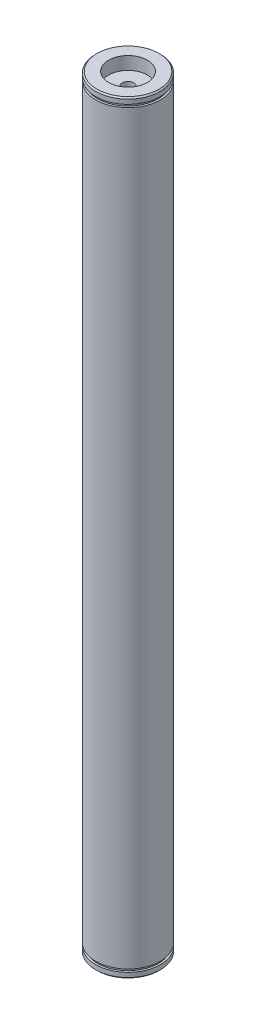
from build123d import *

# Parameters (mm, degrees)
SKETCH_1_R                = 25
EXTRUDE_1_DEPTH           = 295.5
SKETCH_2_R                = 15
CUT_EXTRUDE_1_DEPTH       = 10
HOLE_WIZARD_8_0_8_1_D     = 8
HOLE_WIZARD_8_0_8_1_DEPTH = 119
HOLE_WIZARD_8_0_8_1_TIP   = 2.403442476
SKETCH_5_R                = 3
CUT_EXTRUDE_2_DEPTH       = 100
M10X1_0_1_D               = 9
M10X1_0_1_DEPTH           = 25
M10X1_0_1_TIP             = 2.703872786
CUT_EXTRUDE_START         = -10
SKETCH_8_R                = 15
CUT_EXTRUDE_3_DEPTH       = 10
HOLE_WIZARD_8_0_8_2_D     = 8
HOLE_WIZARD_8_0_8_2_DEPTH = 119
HOLE_WIZARD_8_0_8_2_TIP   = 2.403442476
M10X1_0_2_D               = 9
M10X1_0_2_DEPTH           = 25
M10X1_0_2_TIP             = 2.703872786
SKETCH_12_R               = 3
CUT_EXTRUDE_4_DEPTH       = 51
CHAMFER_1_SIZE            = 1
SKETCH_14_W               = 1.5
SKETCH_14_H               = 2.2


with BuildPart() as part:
    # 草图1 → 凸台-拉伸1 (new, symmetric)
    with BuildSketch(Plane(origin=(0, 0, 0), x_dir=(1, 0, 0), z_dir=(0, 1, 0))):
        with Locations(Location((0, 0, 0), (0, 0, 270))):
            Circle(SKETCH_1_R)
    extrude(amount=EXTRUDE_1_DEPTH, both=True)

    # 草图2 → 切除-拉伸1 (cut)
    with BuildSketch(Plane(origin=(0, 295.5, 0), x_dir=(1, 0, 0), z_dir=(0, 1, 0))):
        with Locations(Location((0, 0, 0), (0, 0, 270))):
            Circle(SKETCH_2_R)
    extrude(amount=-CUT_EXTRUDE_1_DEPTH, mode=Mode.SUBTRACT)

    # Ø8.0 (8) 直径孔1
    with Locations(Plane.ZX.offset(285.5)):
        with Locations((0, 0)):
            Hole(HOLE_WIZARD_8_0_8_1_D / 2, depth=HOLE_WIZARD_8_0_8_1_DEPTH)
            with Locations((0, 0, -(HOLE_WIZARD_8_0_8_1_DEPTH + HOLE_WIZARD_8_0_8_1_TIP / 2))):  # 118° drill point
                Cone(0, HOLE_WIZARD_8_0_8_1_D / 2, HOLE_WIZARD_8_0_8_1_TIP, mode=Mode.SUBTRACT)

    # 草图5 → 切除-拉伸2 (cut)
    with BuildSketch(Plane.XY):
        with Locations((0, 170.5)):
            Circle(SKETCH_5_R)
    extrude(amount=-CUT_EXTRUDE_2_DEPTH, mode=Mode.SUBTRACT)

    # M10x1.0 螺纹孔1
    with Locations(Plane(origin=(0, 285.5, 0), x_dir=(1, 0, 0), z_dir=(0, 1, 0))):
        with Locations((0, 0)):
            Hole(M10X1_0_1_D / 2, depth=M10X1_0_1_DEPTH)
            with Locations((0, 0, -(M10X1_0_1_DEPTH + M10X1_0_1_TIP / 2))):  # 118° drill point
                Cone(0, M10X1_0_1_D / 2, M10X1_0_1_TIP, mode=Mode.SUBTRACT)

    # 草图8 → 切除-拉伸3 (cut)
    with BuildSketch(Plane.XZ.offset(295.5).offset(CUT_EXTRUDE_START)):
        with Locations(Location((0, 0, 0), (0, 0, 90))):
            Circle(SKETCH_8_R)
    extrude(amount=CUT_EXTRUDE_3_DEPTH, mode=Mode.SUBTRACT)

    # Ø8.0 (8) 直径孔2
    with Locations(Plane(origin=(0, -285.5, 0), x_dir=(0, 0, -1), z_dir=(0, -1, 0))):
        with Locations((0, 0)):
            Hole(HOLE_WIZARD_8_0_8_2_D / 2, depth=HOLE_WIZARD_8_0_8_2_DEPTH)
            with Locations((0, 0, -(HOLE_WIZARD_8_0_8_2_DEPTH + HOLE_WIZARD_8_0_8_2_TIP / 2))):  # 118° drill point
                Cone(0, HOLE_WIZARD_8_0_8_2_D / 2, HOLE_WIZARD_8_0_8_2_TIP, mode=Mode.SUBTRACT)

    # M10x1.0 螺纹孔2
    with Locations(Plane(origin=(0, -285.5, 0), x_dir=(-1, 0, 0), z_dir=(0, -1, 0))):
        with Locations((0, 0)):
            Hole(M10X1_0_2_D / 2, depth=M10X1_0_2_DEPTH)
            with Locations((0, 0, -(M10X1_0_2_DEPTH + M10X1_0_2_TIP / 2))):  # 118° drill point
                Cone(0, M10X1_0_2_D / 2, M10X1_0_2_TIP, mode=Mode.SUBTRACT)

    # 草图12 → 切除-拉伸4 (cut)
    with BuildSketch(Plane.XY):
        with Locations(Location((0, -170.5, 0), (0, 0, 90))):
            Circle(SKETCH_12_R)
    extrude(amount=-CUT_EXTRUDE_4_DEPTH, mode=Mode.SUBTRACT)

    # 倒角1
    chamfer_1_edges = [part.edges().sort_by_distance(p)[0] for p in [
        (0, -295.5, -25),
        (0, 295.5, -25),
    ]]
    chamfer(chamfer_1_edges, length=CHAMFER_1_SIZE)

    # 草图14 → 切除-旋转1 (revolve, cut)
    with BuildSketch(Plane(origin=(0, 0, 0), x_dir=(0, 0, -1), z_dir=(1, 0, 0))):
        with Locations((24.25, 289.9)):
            Rectangle(SKETCH_14_W, SKETCH_14_H)
        with Locations((24.25, -289.9)):
            Rectangle(SKETCH_14_W, SKETCH_14_H)
    revolve(axis=Axis((0, 0, 0), (0, 1, 0)), mode=Mode.SUBTRACT)


solid = part.part
